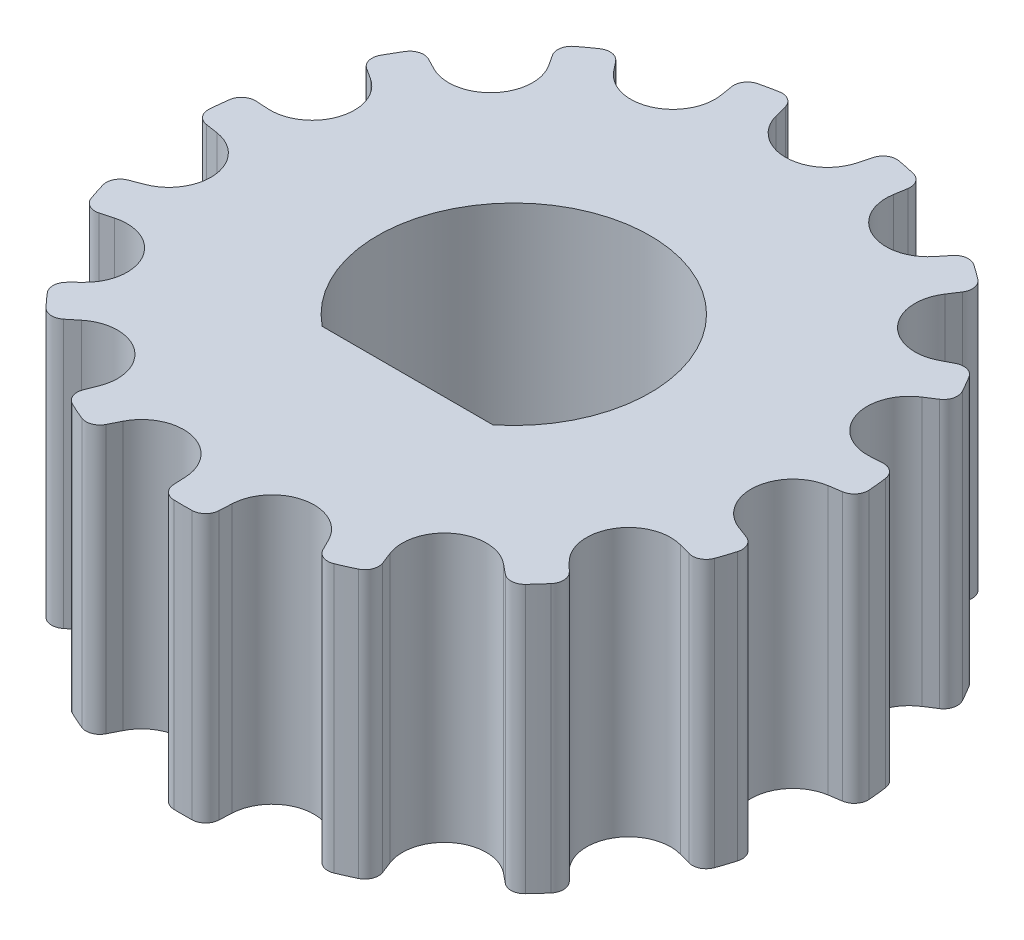
from build123d import *

# Parameters (mm, degrees)
SKETCH1_R           = 7.161972439
BOSS_EXTRUDE1_DEPTH = 5.8
CUT_EXTRUDE1_DEPTH  = 12.671662197
CIRPATTERN1_COUNT   = 15
CUT_EXTRUDE2_DEPTH  = 12.659198501


with BuildPart() as part:
    # Sketch1 → Boss-Extrude1 (new body)
    with BuildSketch(Plane(origin=(0, 0, 0), x_dir=(1, 0, 0), z_dir=(0, 1, 0))):
        with Locations(Location((0, 0, 0), (0, 0, 270))):
            Circle(SKETCH1_R)
    extrude(amount=BOSS_EXTRUDE1_DEPTH)

    # Sketch2 → Cut-Extrude1 (cut, through all)
    with BuildSketch(Plane(origin=(0, 5.8, 0), x_dir=(1, 0, 0), z_dir=(0, 1, 0))):
        with BuildLine():
            Line((-0.879885324, 6.559804793), (-0.95, 6.825530337))
            ThreePointArc((-0.95, 6.825530337), (-1.079308013, 7.002279754), (-1.294287054, 7.044052118))
            ThreePointArc((-1.294287054, 7.044052118), (-2.118539526, 6.841464719), (-2.913036628, 6.54278739))
            Line((-2.913036628, 6.54278739), (-2.913036628, 7.161972439))
            Line((-2.913036628, 7.161972439), (2.913036628, 7.161972439))
            Line((2.913036628, 7.161972439), (2.913036628, 6.54278739))
            ThreePointArc((2.913036628, 6.54278739), (2.118539526, 6.841464719), (1.294287054, 7.044052118))
            ThreePointArc((1.294287054, 7.044052118), (1.079308013, 7.002279754), (0.95, 6.825530337))
            Line((0.95, 6.825530337), (0.879885324, 6.559804793))
            ThreePointArc((0.879885324, 6.559804793), (0, 5.881972439), (-0.879885324, 6.559804793))
        make_face()
    cut_extrude1 = extrude(amount=-CUT_EXTRUDE1_DEPTH, mode=Mode.SUBTRACT)

    # CirPattern1: Cut-Extrude1 ×15 about axis
    cirpattern1_axis = Axis((0, 0, 0), (0, 1, 0))
    for i in range(1, CIRPATTERN1_COUNT):
        add(cut_extrude1.rotate(cirpattern1_axis, i * 360 / CIRPATTERN1_COUNT), mode=Mode.SUBTRACT)

    # Sketch3 → Cut-Extrude2 (cut, through all)
    with BuildSketch(Plane.XZ):
        with BuildLine():
            Line((1.84729532, 2.3), (-1.84729532, 2.3))
            ThreePointArc((-1.84729532, 2.3), (0, -2.95), (1.84729532, 2.3))
        make_face()
    extrude(amount=-CUT_EXTRUDE2_DEPTH, mode=Mode.SUBTRACT)


solid = part.part
